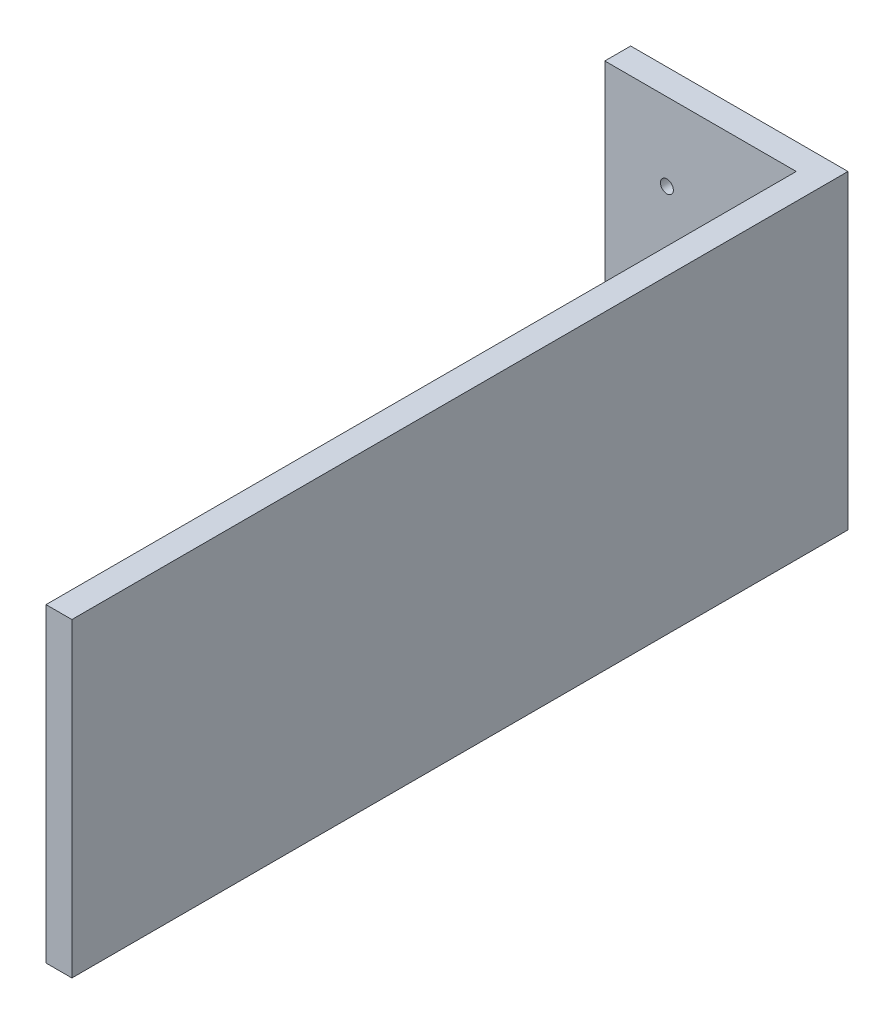
from build123d import *

# Parameters (mm, degrees)
SKETCH_1_W         = 37
SKETCH_1_H         = 60
EXTRUDE_1_DEPTH    = 5
SKETCH_1_3_W       = 5
SKETCH_1_3_H       = 60
EXTRUDE_2_DEPTH    = 150
HOLE_WIZARD_M3_1_D = 2.5


with BuildPart() as part:
    # 草图1 → 凸台-拉伸1 (new body)
    with BuildSketch(Plane.XY):
        with Locations((-2.380104714, 0)):
            Rectangle(SKETCH_1_W, SKETCH_1_H)
    extrude(amount=EXTRUDE_1_DEPTH)

    # 草图1<3> → 凸台-拉伸2 (add)
    with BuildSketch(Plane.XY):
        with Locations((18.619895286, 0)):
            Rectangle(SKETCH_1_3_W, SKETCH_1_3_H)
    extrude(amount=EXTRUDE_2_DEPTH)

    # M3 螺纹孔的螺纹孔钻头1 (through all)
    with Locations(Plane(origin=(-8.880104714, 15, 5), x_dir=(1, 0, 0), z_dir=(0, 0, 1))):
        with Locations((0, 0), (15, 0)):
            hole_wizard_m3_1 = Hole(HOLE_WIZARD_M3_1_D / 2)

    # 镜向1: M3 螺纹孔的螺纹孔钻头1 across plane
    add(hole_wizard_m3_1.mirror(Plane.ZX), mode=Mode.SUBTRACT)


solid = part.part
